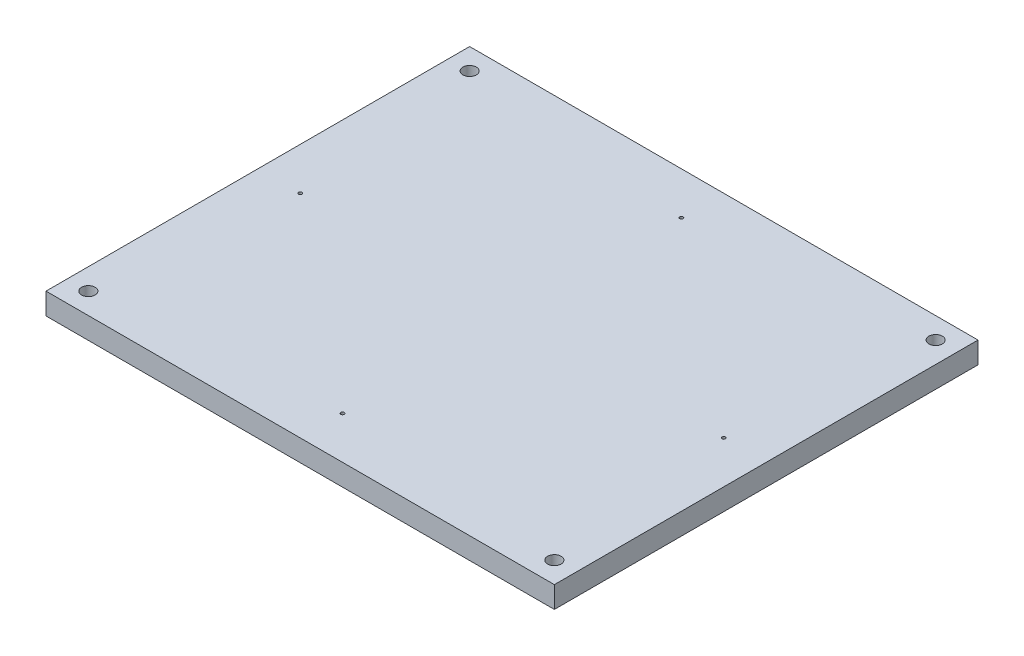
from build123d import *

# Parameters (mm, degrees)
ESBO_O2_W                      = 1200
ESBO_O2_H                      = 1000
RESSALTO_EXTRUS_O1_DEPTH       = 50.8
CORTE_EXTRUS_O1_DEPTH          = 783.675309436
FURO_DE_DI_METRO_8_0_8_1_D     = 8
FURO_DE_DI_METRO_8_0_8_1_DEPTH = 15
FURO_DE_DI_METRO_8_0_8_1_TIP   = 2.403442476


with BuildPart() as part:
    # Esboço2 → Ressalto-extrusão1 (new body)
    with BuildSketch(Plane(origin=(0, 0, 0), x_dir=(1, 0, 0), z_dir=(0, 1, 0))):
        Rectangle(ESBO_O2_W, ESBO_O2_H)
    extrude(amount=RESSALTO_EXTRUS_O1_DEPTH)

    # Esboço3 → Corte-extrusão1 (cut, through all)
    with BuildSketch(Plane(origin=(0, 50.8, 0), x_dir=(1, 0, 0), z_dir=(0, 1, 0))):
        with BuildLine():
            ThreePointArc((-534, 450), (-561.313708499, 461.313708499), (-550, 434))
            Line((-550, 434), (-550, 450))
            Line((-550, 450), (-534, 450))
        make_face()
        with BuildLine():
            Line((-550, 450), (-550, 434))
            ThreePointArc((-550, 434), (-538.686291501, 438.686291501), (-534, 450))
            Line((-534, 450), (-550, 450))
        make_face()
        with BuildLine():
            ThreePointArc((534, 450), (538.686291501, 438.686291501), (550, 434))
            Line((550, 434), (550, 450))
            Line((550, 450), (534, 450))
        make_face()
        with BuildLine():
            Line((550, 450), (550, 434))
            ThreePointArc((550, 434), (561.313708499, 438.686291501), (566, 450))
            ThreePointArc((566, 450), (550, 466), (534, 450))
            Line((534, 450), (550, 450))
        make_face()
        with BuildLine():
            ThreePointArc((550, -434), (538.686291501, -438.686291501), (534, -450))
            Line((534, -450), (550, -450))
            Line((550, -450), (550, -434))
        make_face()
        with BuildLine():
            Line((550, -450), (534, -450))
            ThreePointArc((534, -450), (550, -466), (566, -450))
            ThreePointArc((566, -450), (561.313708499, -438.686291501), (550, -434))
            Line((550, -434), (550, -450))
        make_face()
        with BuildLine():
            Line((-550, -434), (-550, -450))
            Line((-550, -450), (-534, -450))
            ThreePointArc((-534, -450), (-538.686291501, -438.686291501), (-550, -434))
        make_face()
        with BuildLine():
            Line((-534, -450), (-550, -450))
            Line((-550, -450), (-550, -434))
            ThreePointArc((-550, -434), (-561.313708499, -461.313708499), (-534, -450))
        make_face()
    extrude(amount=-CORTE_EXTRUS_O1_DEPTH, mode=Mode.SUBTRACT)

    # Furo de diâmetro Ø8.0 (8)1
    with Locations(Plane(origin=(0, 50.8, 0), x_dir=(1, 0, 0), z_dir=(0, 1, 0))):
        with Locations((-500, 0), (0, 400), (500, 0), (0, -400)):
            Hole(FURO_DE_DI_METRO_8_0_8_1_D / 2, depth=FURO_DE_DI_METRO_8_0_8_1_DEPTH)
            with Locations((0, 0, -(FURO_DE_DI_METRO_8_0_8_1_DEPTH + FURO_DE_DI_METRO_8_0_8_1_TIP / 2))):  # 118° drill point
                Cone(0, FURO_DE_DI_METRO_8_0_8_1_D / 2, FURO_DE_DI_METRO_8_0_8_1_TIP, mode=Mode.SUBTRACT)


solid = part.part
